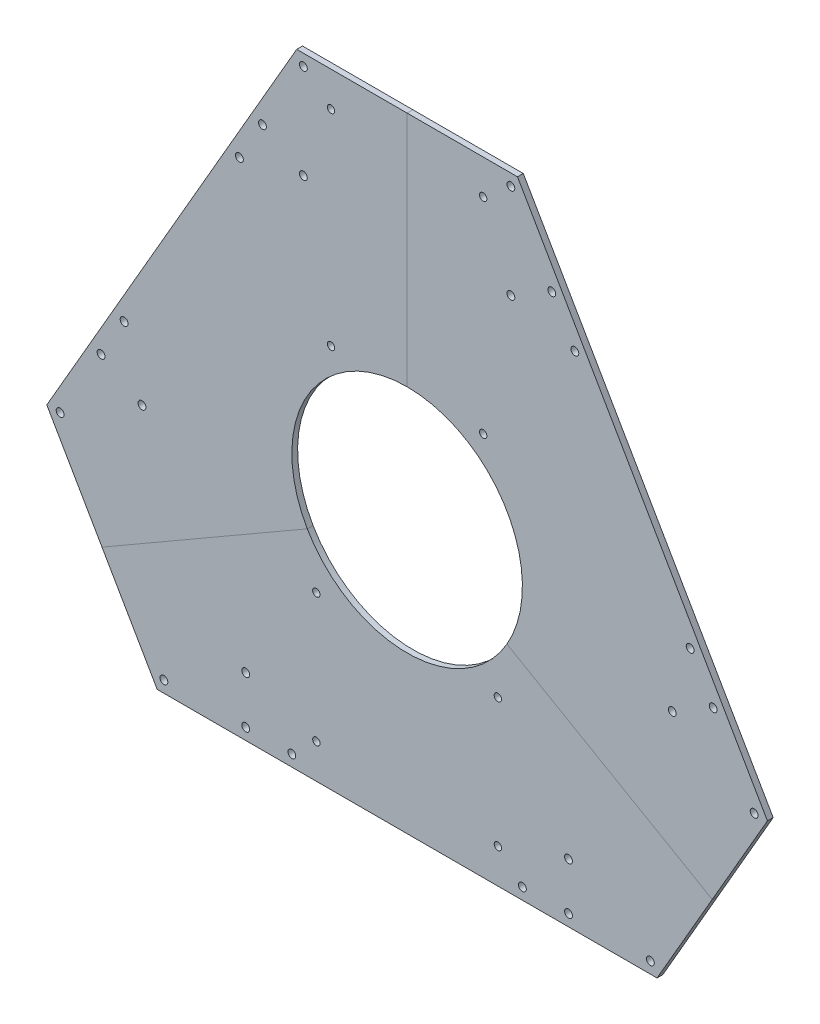
from build123d import *

# Parameters (mm, degrees)
SKETCH_1_R               = 1.7
EXTRUDE_1_DEPTH          = 2.5
PATTERN_CIRCULAR_1_COUNT = 3
SKETCH_2_R               = 1.6
CUT_EXTRUDE_1_DEPTH      = 219.587953522
SKETCH_3_R               = 1.6
CUT_EXTRUDE_2_DEPTH      = 219.587953522
SKETCH_4_R               = 1.6
CUT_EXTRUDE_3_DEPTH      = 219.587953522


with BuildPart() as part:
    # ｽｹｯﾁ1 → ﾎﾞｽ - 押し出し1 (new body)
    with BuildSketch(Plane.XY):
        with BuildLine():
            ThreePointArc((0, 50), (43.301270189, 25), (43.301270189, -25))
            Line((43.301270189, -25), (132.337168574, -76.4048999))
            Line((132.337168574, -76.4048999), (156.280544247, -34.93375673))
            Line((156.280544247, -34.93375673), (47.886751346, 152.8097998))
            Line((47.886751346, 152.8097998), (0, 152.8097998))
            Line((0, 152.8097998), (0, 50))
        make_face()
        with Locations((115, -14.43375673)):
            Circle(SKETCH_1_R, mode=Mode.SUBTRACT)
        with Locations((132.753520778, -4.18375673)):
            Circle(SKETCH_1_R, mode=Mode.SUBTRACT)
        with Locations((150.507041555, -34.93375673)):
            Circle(SKETCH_1_R, mode=Mode.SUBTRACT)
        with Locations((122.753520778, 13.136751346)):
            Circle(SKETCH_1_R, mode=Mode.SUBTRACT)
        with Locations((72.753520778, 99.739291724)):
            Circle(SKETCH_1_R, mode=Mode.SUBTRACT)
        with Locations((45, 106.8097998)):
            Circle(SKETCH_1_R, mode=Mode.SUBTRACT)
        with Locations((45, 147.8097998)):
            Circle(SKETCH_1_R, mode=Mode.SUBTRACT)
        with Locations((62.753520778, 117.0597998)):
            Circle(SKETCH_1_R, mode=Mode.SUBTRACT)
    extrude(amount=EXTRUDE_1_DEPTH)


with BuildPart() as pattern_circular_1_1:
    # 円形ﾊﾟﾀｰﾝ1: pattern copy
    add(part.part.rotate(Axis((0, 0, 0), (0, 0, 1)), 1 * 360 / PATTERN_CIRCULAR_1_COUNT))

    # ｽｹｯﾁ4 → ｶｯﾄ - 押し出し3 (cut, through all)
    with BuildSketch(Plane.XY.offset(2.5)):
        with Locations((-33, 137.8097998)):
            Circle(SKETCH_4_R)
        with Locations((-33, 48.8097998)):
            Circle(SKETCH_4_R)
    extrude(amount=-CUT_EXTRUDE_3_DEPTH, mode=Mode.SUBTRACT)


with BuildPart() as pattern_circular_1_2:
    # 円形ﾊﾟﾀｰﾝ1: pattern copy
    add(part.part.rotate(Axis((0, 0, 0), (0, 0, 1)), 2 * 360 / PATTERN_CIRCULAR_1_COUNT))

    # ｽｹｯﾁ2 → ｶｯﾄ - 押し出し1 (cut, through all)
    with BuildSketch(Plane.XY.offset(2.5)):
        with Locations((39.37, -102.87604307)):
            Circle(SKETCH_2_R)
        with Locations((-39.37, -102.87604307)):
            Circle(SKETCH_2_R)
        with Locations((-39.37, -46.99604307)):
            Circle(SKETCH_2_R)
        with Locations((39.37, -46.99604307)):
            Circle(SKETCH_2_R)
    extrude(amount=-CUT_EXTRUDE_1_DEPTH, mode=Mode.SUBTRACT)


with BuildPart() as part_1:
    add(part.part)

    # ｽｹｯﾁ3 → ｶｯﾄ - 押し出し2 (cut, through all)
    with BuildSketch(Plane.XY.offset(2.5)):
        with Locations((33, 137.8097998)):
            Circle(SKETCH_3_R)
        with Locations((33, 48.8097998)):
            Circle(SKETCH_3_R)
    extrude(amount=-CUT_EXTRUDE_2_DEPTH, mode=Mode.SUBTRACT)


solid = Compound([pattern_circular_1_1.part, pattern_circular_1_2.part, part_1.part])
